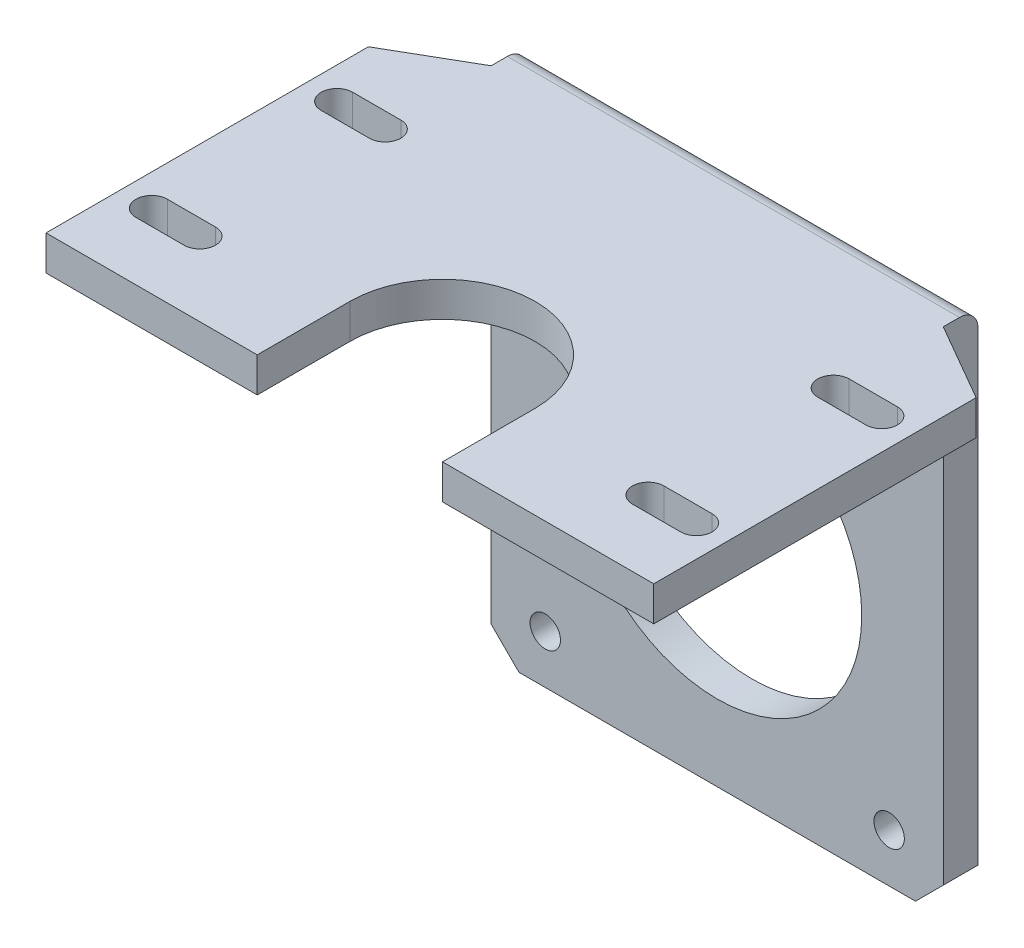
from build123d import *

# Parameters (mm, degrees)
SKETCH1_R           = 19.812
SKETCH1_R_2         = 2.0828
BOSS_EXTRUDE1_DEPTH = 4.7625
BOSS_EXTRUDE2_DEPTH = 4.7625
FILLET1_R           = 2.54


with BuildPart() as part:
    # Sketch1 → Boss-Extrude1 (new body)
    with BuildSketch(Plane.XY):
        Polygon((-27.178, -30.226), (27.178, -30.226), (30.988, -26.416), (30.988, 39.878), (-30.988, 39.878), (-30.988, -26.416), align=None)
        with Locations(Location((0, 0, 0), (0, 0, 180))):
            Circle(SKETCH1_R, mode=Mode.SUBTRACT)
        with Locations(Location((-23.5712, 23.5712, 0), (0, 0, 180))):
            Circle(SKETCH1_R_2, mode=Mode.SUBTRACT)
        with Locations(Location((23.5712, 23.5712, 0), (0, 0, 180))):
            Circle(SKETCH1_R_2, mode=Mode.SUBTRACT)
        with Locations(Location((23.5712, -23.5712, 0), (0, 0, 180))):
            Circle(SKETCH1_R_2, mode=Mode.SUBTRACT)
        with Locations(Location((-23.5712, -23.5712, 0), (0, 0, 180))):
            Circle(SKETCH1_R_2, mode=Mode.SUBTRACT)
    extrude(amount=BOSS_EXTRUDE1_DEPTH)

    # Sketch4 → Boss-Extrude2 (add)
    with BuildSketch(Plane(origin=(0, 39.878, 0), x_dir=(-1, 0, 0), z_dir=(0, 1, 0))):
        with BuildLine():
            Line((12.7, 55.118), (41.656, 55.118))
            Line((41.656, 55.118), (41.656, 10.921672672))
            Line((41.656, 10.921672672), (30.988, 4.7625))
            Line((30.988, 4.7625), (30.988, 0))
            Line((30.988, 0), (-30.988, 0))
            Line((-30.988, 0), (-30.988, 4.7625))
            Line((-30.988, 4.7625), (-41.656, 10.921672672))
            Line((-41.656, 10.921672672), (-41.656, 55.118))
            Line((-41.656, 55.118), (-12.7, 55.118))
            Line((-12.7, 55.118), (-12.7, 42.418))
            ThreePointArc((-12.7, 42.418), (0, 29.718), (12.7, 42.418))
            Line((12.7, 42.418), (12.7, 55.118))
        make_face()
        with BuildLine():
            Line((-30.734, 47.117), (-37.338, 47.117))
            ThreePointArc((-37.338, 47.117), (-39.497, 44.958), (-37.338, 42.799))
            Line((-37.338, 42.799), (-30.734, 42.799))
            ThreePointArc((-30.734, 42.799), (-28.575, 44.958), (-30.734, 47.117))
        make_face(mode=Mode.SUBTRACT)
        with BuildLine():
            Line((-30.734, 21.717), (-37.338, 21.717))
            ThreePointArc((-37.338, 21.717), (-39.497, 19.558), (-37.338, 17.399))
            Line((-37.338, 17.399), (-30.734, 17.399))
            ThreePointArc((-30.734, 17.399), (-28.575, 19.558), (-30.734, 21.717))
        make_face(mode=Mode.SUBTRACT)
        with BuildLine():
            Line((37.338, 17.399), (30.734, 17.399))
            ThreePointArc((30.734, 17.399), (28.575, 19.558), (30.734, 21.717))
            Line((30.734, 21.717), (37.338, 21.717))
            ThreePointArc((37.338, 21.717), (39.497, 19.558), (37.338, 17.399))
        make_face(mode=Mode.SUBTRACT)
        with BuildLine():
            Line((37.338, 42.799), (30.734, 42.799))
            ThreePointArc((30.734, 42.799), (28.575, 44.958), (30.734, 47.117))
            Line((30.734, 47.117), (37.338, 47.117))
            ThreePointArc((37.338, 47.117), (39.497, 44.958), (37.338, 42.799))
        make_face(mode=Mode.SUBTRACT)
    extrude(amount=-BOSS_EXTRUDE2_DEPTH)

    # Fillet1
    fillet1_edges = [part.edges().sort_by_distance(p)[0] for p in [
        (0, 35.1155, 4.7625),
        (0, 39.878, 0),
    ]]
    fillet(fillet1_edges, radius=FILLET1_R)


solid = part.part
